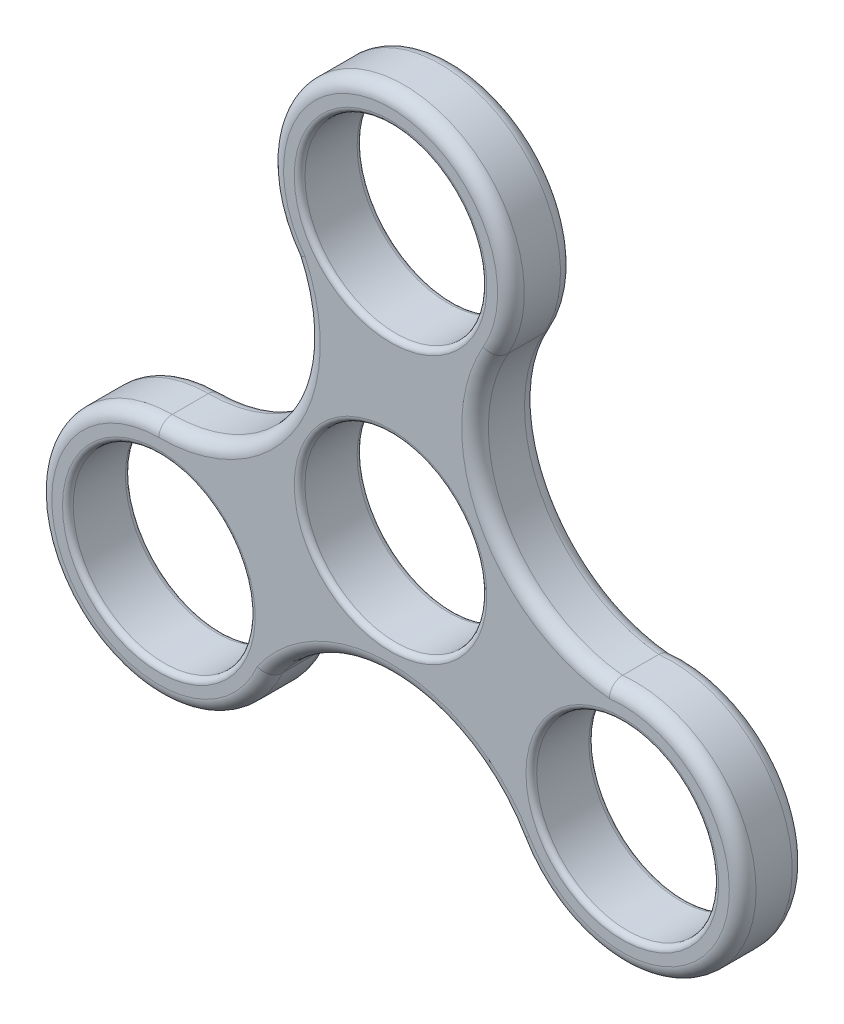
from build123d import *

# Parameters (mm, degrees)
SKETCH1_R           = 68
BOSS_EXTRUDE1_DEPTH = 47
FILLET1_R           = 10
FILLET2_R           = 4


with BuildPart() as part:
    # Sketch1 → Boss-Extrude1 (new body)
    with BuildSketch(Plane.XY):
        with BuildLine():
            ThreePointArc((77.942286341, 155), (-4.886238474, 289.867261411), (-72.603773577, 146.814550276))
            ThreePointArc((-72.603773577, 146.814550276), (-80.050067225, 40.914898819), (-173.205080757, -10))
            ThreePointArc((-173.205080757, -10), (-248.589292871, -149.165237353), (-90.843243396, -136.283987467))
            ThreePointArc((-90.843243396, -136.283987467), (4.591691842, -89.782841201), (95.262794416, -145))
            ThreePointArc((95.262794416, -145), (253.475531345, -140.702024058), (163.447016973, -10.530562809))
            ThreePointArc((163.447016973, -10.530562809), (75.458375383, 48.867942382), (77.942286341, 155))
        make_face()
        Circle(SKETCH1_R, mode=Mode.SUBTRACT)
        with Locations((-173.205080757, -100)):
            Circle(SKETCH1_R, mode=Mode.SUBTRACT)
        with Locations((173.205080757, -100)):
            Circle(SKETCH1_R, mode=Mode.SUBTRACT)
        with Locations((0, 200)):
            Circle(SKETCH1_R, mode=Mode.SUBTRACT)
    extrude(amount=BOSS_EXTRUDE1_DEPTH)

    # Fillet1
    fillet1_edges = [part.edges().sort_by_distance(p)[0] for p in [
        (4.591691842, -89.782841201, 47),
        (253.475531345, -140.702024058, 47),
        (75.458375383, 48.867942382, 47),
        (-4.886238474, 289.867261411, 47),
        (-80.050067225, 40.914898819, 47),
        (-4.886238474, 289.867261411, 0),
        (75.458375383, 48.867942382, 0),
        (253.475531345, -140.702024058, 0),
        (-248.589292871, -149.165237353, 47),
        (4.591691842, -89.782841201, 0),
        (-248.589292871, -149.165237353, 0),
        (-80.050067225, 40.914898819, 0),
    ]]
    fillet(fillet1_edges, radius=FILLET1_R)

    # Fillet2
    fillet2_edges = [part.edges().sort_by_distance(p)[0] for p in [
        (-68, 0, 0),
        (-68, 0, 47),
        (-241.205080757, -100, 0),
        (-241.205080757, -100, 47),
        (105.205080757, -100, 0),
        (105.205080757, -100, 47),
        (-68, 200, 0),
        (-68, 200, 47),
    ]]
    fillet(fillet2_edges, radius=FILLET2_R)


solid = part.part
